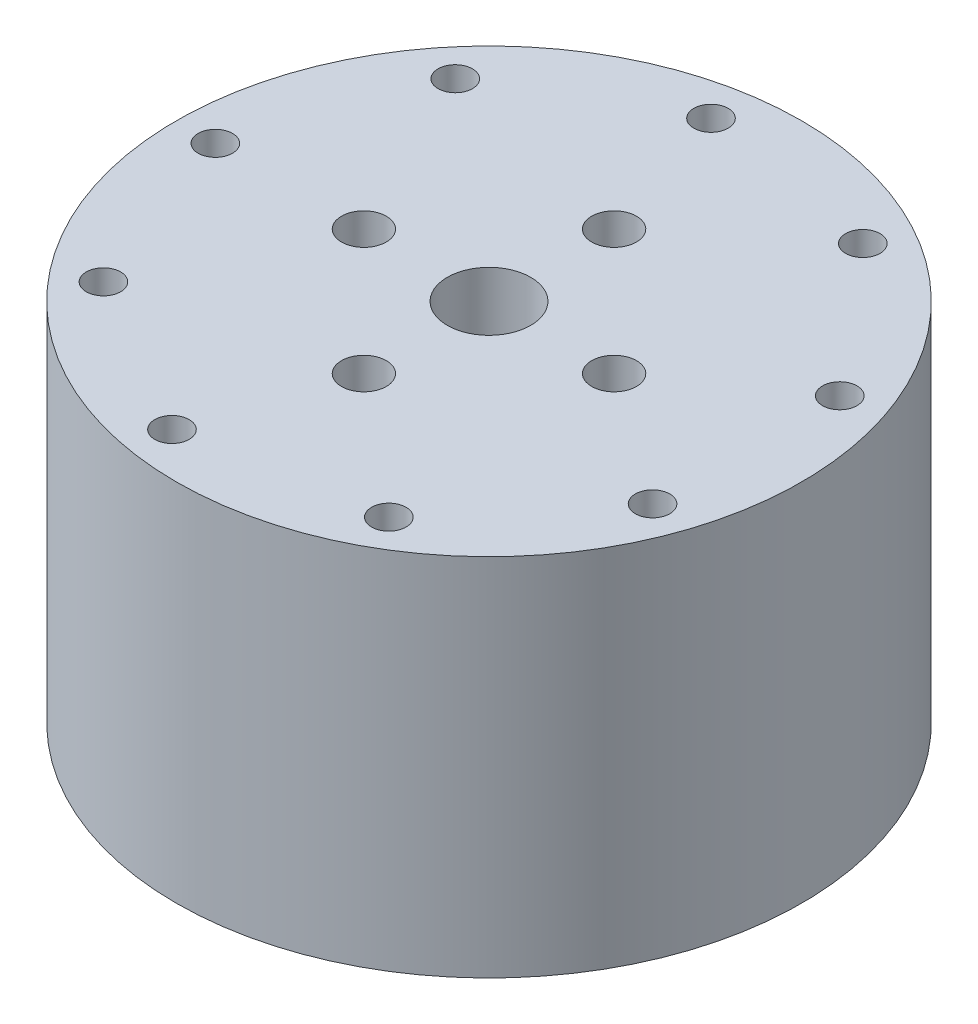
from build123d import *

# Parameters (mm, degrees)
SKETCH_1_R          = 30
EXTRUDE_1_DEPTH     = 35
SKETCH_2_R          = 1.65
CUT_EXTRUDE_1_DEPTH = 56
SKETCH_4_R          = 20
CUT_EXTRUDE_3_DEPTH = 10
SKETCH_5_R          = 4
CUT_EXTRUDE_4_DEPTH = 50.244289009
SKETCH_6_R          = 2.15
CUT_EXTRUDE_5_DEPTH = 50.244289009


with BuildPart() as part:
    # 草图1 → 凸台-拉伸1 (new body)
    with BuildSketch(Plane(origin=(0, 0, 0), x_dir=(1, 0, 0), z_dir=(0, 1, 0))):
        with Locations(Location((0, 0, 0), (0, 0, 270))):
            Circle(SKETCH_1_R)
    extrude(amount=EXTRUDE_1_DEPTH)

    # 草图2 → 切除-拉伸1 (cut, through all)
    with BuildSketch(Plane.XZ):
        with Locations(Location((-26.25, 0, 0), (0, 0, 270))):
            Circle(SKETCH_2_R)
        with Locations(Location((-20.108666632, 16.873174754, 0), (0, 0, 270))):
            Circle(SKETCH_2_R)
        with Locations(Location((-4.558264664, 25.851203517, 0), (0, 0, 270))):
            Circle(SKETCH_2_R)
        with Locations(Location((13.125, 22.733166849, 0), (0, 0, 270))):
            Circle(SKETCH_2_R)
        with Locations(Location((24.666931296, 8.978028762, 0), (0, 0, 270))):
            Circle(SKETCH_2_R)
        with Locations(Location((24.666931296, -8.978028762, 0), (0, 0, 270))):
            Circle(SKETCH_2_R)
        with Locations(Location((13.125, -22.733166849, 0), (0, 0, 270))):
            Circle(SKETCH_2_R)
        with Locations(Location((-4.558264664, -25.851203517, 0), (0, 0, 270))):
            Circle(SKETCH_2_R)
        with Locations(Location((-20.108666632, -16.873174754, 0), (0, 0, 270))):
            Circle(SKETCH_2_R)
    extrude(amount=-CUT_EXTRUDE_1_DEPTH, mode=Mode.SUBTRACT)

    # 草图4 → 切除-拉伸3 (cut)
    with BuildSketch(Plane.XZ):
        with Locations(Location((0, 0, 0), (0, 0, 270))):
            Circle(SKETCH_4_R)
    extrude(amount=-CUT_EXTRUDE_3_DEPTH, mode=Mode.SUBTRACT)

    # 草图5 → 切除-拉伸4 (cut, through all)
    with BuildSketch(Plane.XZ.offset(-10)):
        with Locations(Location((0, 0, 0), (0, 0, 270))):
            Circle(SKETCH_5_R)
    extrude(amount=-CUT_EXTRUDE_4_DEPTH, mode=Mode.SUBTRACT)

    # 草图6 → 切除-拉伸5 (cut, through all)
    with BuildSketch(Plane.XZ.offset(-10)):
        with Locations(Location((0, 12, 0), (0, 0, 270))):
            Circle(SKETCH_6_R)
        with Locations(Location((12, 0, 0), (0, 0, 270))):
            Circle(SKETCH_6_R)
        with Locations(Location((0, -12, 0), (0, 0, 270))):
            Circle(SKETCH_6_R)
        with Locations(Location((-12, 0, 0), (0, 0, 270))):
            Circle(SKETCH_6_R)
    extrude(amount=-CUT_EXTRUDE_5_DEPTH, mode=Mode.SUBTRACT)


solid = part.part
